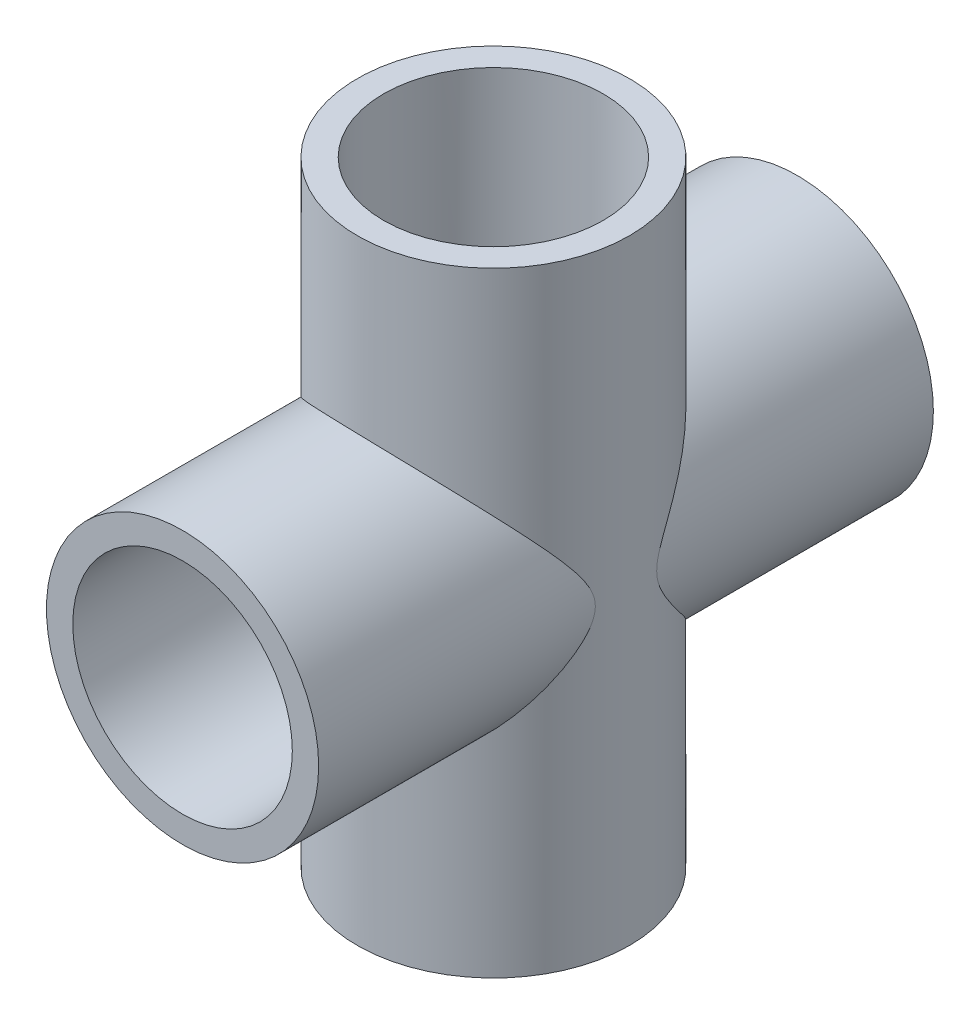
from build123d import *

# Parameters (mm, degrees)
SKETCH2_R           = 155
SKETCH2_R_2         = 125
EXTRUDE_THIN1_DEPTH = 700
SKETCH3_R           = 155
SKETCH3_R_2         = 125
EXTRUDE_THIN2_DEPTH = 350


with BuildPart() as part:
    # Sketch2 → Extrude-Thin1 (new body)
    with BuildSketch(Plane.XY):
        Circle(SKETCH2_R)
        Circle(SKETCH2_R_2, mode=Mode.SUBTRACT)
    extrude(amount=EXTRUDE_THIN1_DEPTH)

    # Sketch3 → Extrude-Thin2 (add, symmetric)
    with BuildSketch(Plane(origin=(0, 0, 0), x_dir=(1, 0, 0), z_dir=(0, 1, 0))):
        with Locations((3.991420873, -350)):
            Circle(SKETCH3_R)
        with Locations((3.991420873, -350)):
            Circle(SKETCH3_R_2, mode=Mode.SUBTRACT)
    extrude(amount=EXTRUDE_THIN2_DEPTH, both=True)


solid = part.part
